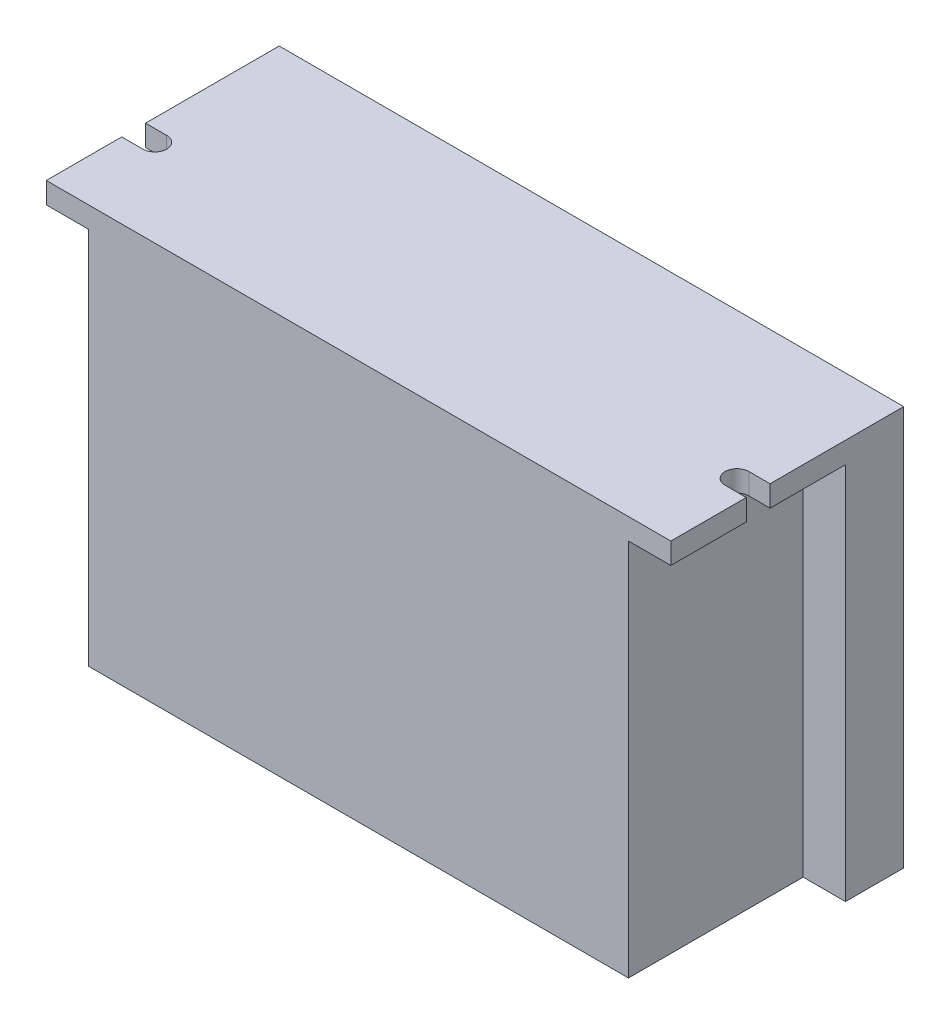
from build123d import *

# Parameters (mm, degrees)
ESQUISSE1_W             = 118
ESQUISSE1_H             = 75.5
BOSS_EXTRU_1_DEPTH      = 11
BOSS_EXTRU_2_DEPTH      = 33
ENL_V_MAT_EXTRU_1_REACH = 107.929


with BuildPart() as part:
    # Esquisse1 → Boss.-Extru.1 (new body)
    with BuildSketch(Plane.XY):
        with Locations((-5.596837945, -6.384387352)):
            Rectangle(ESQUISSE1_W, ESQUISSE1_H)
    extrude(amount=BOSS_EXTRU_1_DEPTH)

    # Esquisse2 → Boss.-Extru.2 (add)
    with BuildSketch(Plane.XY.offset(11)):
        Polygon((-64.596837945, 31.365612648), (53.403162055, 31.365612648), (53.403162055, 27.365612648), (45.403162055, 27.365612648), (45.403162055, -44.134387352), (-56.596837945, -44.134387352), (-56.596837945, 27.365612648), (-64.596837945, 27.365612648), align=None)
    extrude(amount=BOSS_EXTRU_2_DEPTH)

    # Esquisse3 → Enlèv. mat.-Extru.1 (cut, up to next)
    with BuildSketch(Plane.XZ.offset(-27.365612648), mode=Mode.PRIVATE) as enl_v_mat_extru_1_sk1:
        with BuildLine():
            Line((-64.596837945, 29.75), (-60.596837945, 29.75))
            ThreePointArc((-60.596837945, 29.75), (-58.346837945, 27.5), (-60.596837945, 25.25))
            Line((-60.596837945, 25.25), (-64.596837945, 25.25))
            Line((-64.596837945, 25.25), (-64.596837945, 29.75))
        make_face()
    enl_v_mat_extru_1_tool1 = extrude(enl_v_mat_extru_1_sk1.sketch, amount=-ENL_V_MAT_EXTRU_1_REACH, mode=Mode.PRIVATE) & part.part
    # Esquisse3 → Enlèv. mat.-Extru.1 (cut, up to next)
    with BuildSketch(Plane.XZ.offset(-27.365612648), mode=Mode.PRIVATE) as enl_v_mat_extru_1_sk2:
        with BuildLine():
            Line((53.403162055, 29.75), (49.403162055, 29.75))
            ThreePointArc((49.403162055, 29.75), (47.153162055, 27.5), (49.403162055, 25.25))
            Line((49.403162055, 25.25), (53.403162055, 25.25))
            Line((53.403162055, 25.25), (53.403162055, 29.75))
        make_face()
    enl_v_mat_extru_1_tool2 = extrude(enl_v_mat_extru_1_sk2.sketch, amount=-ENL_V_MAT_EXTRU_1_REACH, mode=Mode.PRIVATE) & part.part
    add(enl_v_mat_extru_1_tool1.solids().sort_by_distance((-61.6914, 27.365613, 27.5))[0], mode=Mode.SUBTRACT)
    add(enl_v_mat_extru_1_tool2.solids().sort_by_distance((50.497724, 27.365613, 27.5))[0], mode=Mode.SUBTRACT)


solid = part.part
